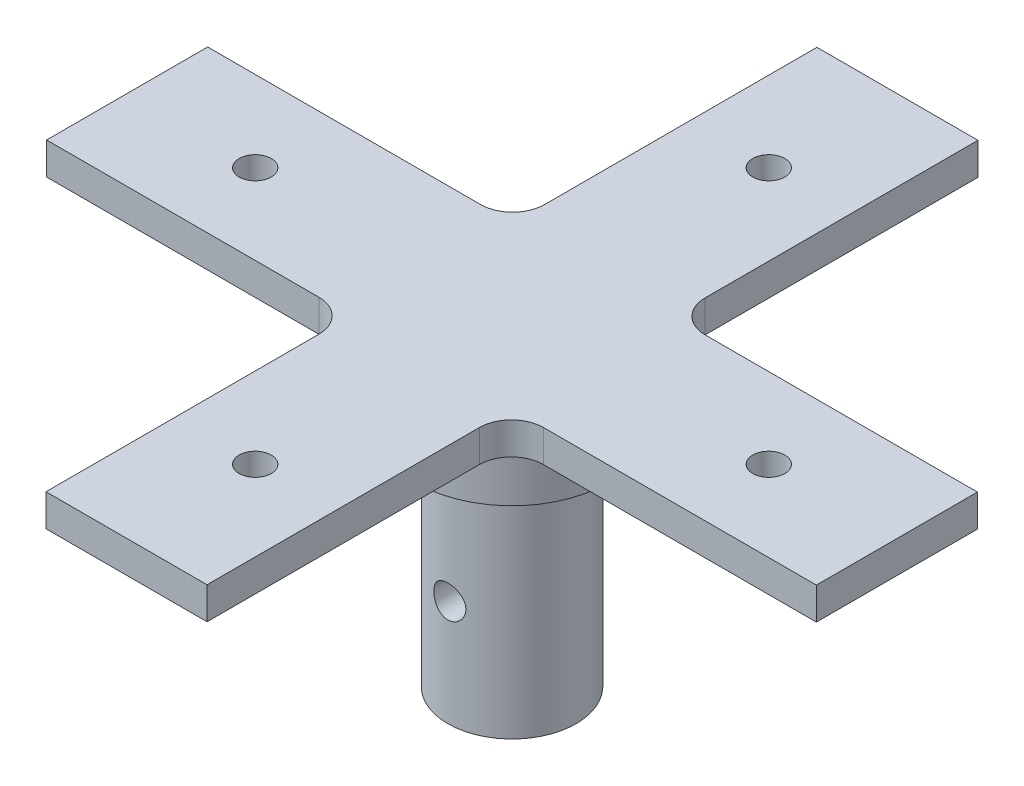
from build123d import *

# Parameters (mm, degrees)
SKETCH1_R               = 10
BOSS_EXTRUDE1_DEPTH     = 35
SKETCH2_R               = 15
BOSS_EXTRUDE2_DEPTH     = 10
SKETCH3_R               = 2.5
BOSS_EXTRUDE3_DEPTH     = 5
CUT_EXTRUDE1_DEPTH      = 50
CUT_EXTRUDE1_DEPTH_BACK = 26
SKETCH7_R               = 2.5


with BuildPart() as part:
    # Sketch1 → Boss-Extrude1 (new body)
    with BuildSketch(Plane(origin=(0, 0, 0), x_dir=(1, 0, 0), z_dir=(0, 1, 0))):
        with Locations(Location((0, 0, 0), (0, 0, 270))):
            Circle(SKETCH1_R)
    extrude(amount=BOSS_EXTRUDE1_DEPTH)

    # Sketch2 → Boss-Extrude2 (add)
    with BuildSketch(Plane(origin=(0, 35, 0), x_dir=(1, 0, 0), z_dir=(0, 1, 0))):
        with Locations(Location((0, 0, 0), (0, 0, 270))):
            Circle(SKETCH2_R)
    extrude(amount=BOSS_EXTRUDE2_DEPTH)

    # Sketch3 → Boss-Extrude3 (add)
    with BuildSketch(Plane(origin=(0, 45, 0), x_dir=(1, 0, 0), z_dir=(0, 1, 0))):
        with BuildLine():
            Line((-60, 0), (-60, 12.589573297))
            Line((-60, 12.589573297), (-17.498503567, 12.589573297))
            ThreePointArc((-17.498503567, 12.589573297), (-13.964027799, 14.053601095), (-12.5, 17.588076863))
            Line((-12.5, 17.588076863), (-12.5, 60))
            Line((-12.5, 60), (12.589573297, 60))
            Line((12.589573297, 60), (12.589573297, 17.498503567))
            ThreePointArc((12.589573297, 17.498503567), (14.053601095, 13.964027799), (17.588076863, 12.5))
            Line((17.588076863, 12.5), (60, 12.5))
            Line((60, 12.5), (60, -12.589573297))
            Line((60, -12.589573297), (17.498503567, -12.589573297))
            ThreePointArc((17.498503567, -12.589573297), (13.964027799, -14.053601095), (12.5, -17.588076863))
            Line((12.5, -17.588076863), (12.5, -60))
            Line((12.5, -60), (-12.589573297, -60))
            Line((-12.589573297, -60), (-12.589573297, -17.498503567))
            ThreePointArc((-12.589573297, -17.498503567), (-14.053601095, -13.964027799), (-17.588076863, -12.5))
            Line((-17.588076863, -12.5), (-60, -12.5))
            Line((-60, -12.5), (-60, 0))
        make_face()
        with Locations(Location((0, 40, 0), (0, 0, 270))):
            Circle(SKETCH3_R, mode=Mode.SUBTRACT)
        with Locations(Location((40, 0, 0), (0, 0, 270))):
            Circle(SKETCH3_R, mode=Mode.SUBTRACT)
        with Locations(Location((0, -40, 0), (0, 0, 270))):
            Circle(SKETCH3_R, mode=Mode.SUBTRACT)
        with Locations(Location((-40, 0, 0), (0, 0, 270))):
            Circle(SKETCH3_R, mode=Mode.SUBTRACT)
    extrude(amount=BOSS_EXTRUDE3_DEPTH)

    # Sketch7 → Cut-Extrude1 (cut, two sides: drawn at the far end of the back side and taken through both)
    with BuildSketch(Plane.XY.offset(-CUT_EXTRUDE1_DEPTH_BACK)):
        with Locations(Location((0, 16.5, 0), (0, 0, 90.000000004))):
            Circle(SKETCH7_R)
    extrude(amount=CUT_EXTRUDE1_DEPTH + CUT_EXTRUDE1_DEPTH_BACK, mode=Mode.SUBTRACT)


solid = part.part
